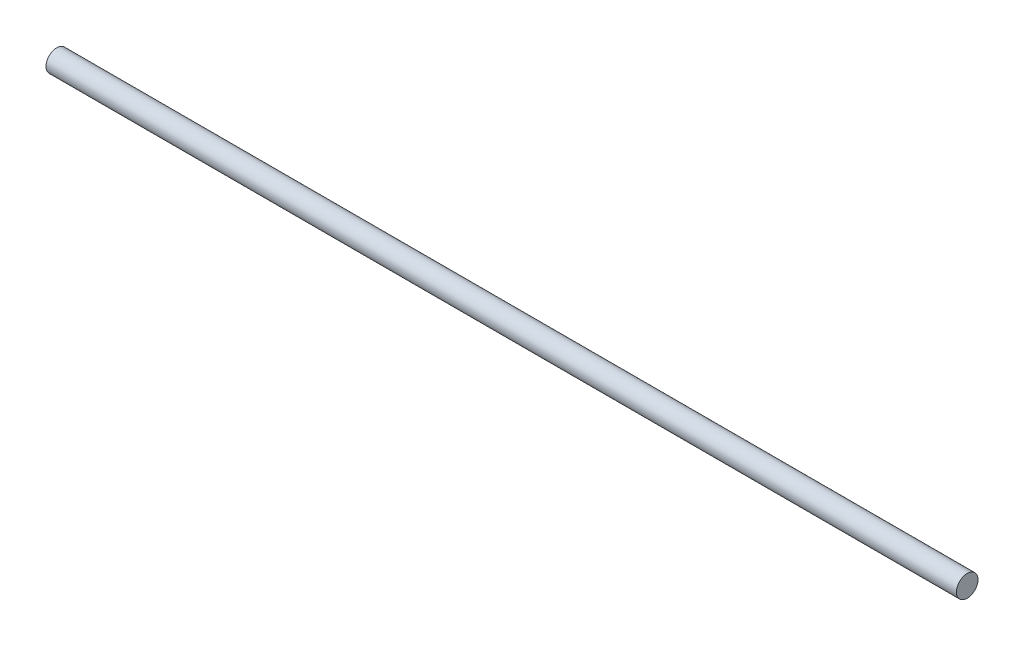
from build123d import *

# Parameters (mm, degrees)
BOSS_EXTRUDE1_DEPTH      = 527.5
BOSS_EXTRUDE1_DEPTH_BACK = 527.5
SKETCH1_R                = 12.5


with BuildPart() as part:
    # Sketch1 → Boss-Extrude1 (new, two sides: drawn at the far end of the back side and taken through both)
    with BuildSketch(Plane(origin=(0, 0, 0), x_dir=(0, 0, -1), z_dir=(1, 0, 0)).offset(-BOSS_EXTRUDE1_DEPTH_BACK)):
        Circle(SKETCH1_R)
    extrude(amount=BOSS_EXTRUDE1_DEPTH + BOSS_EXTRUDE1_DEPTH_BACK)


solid = part.part
